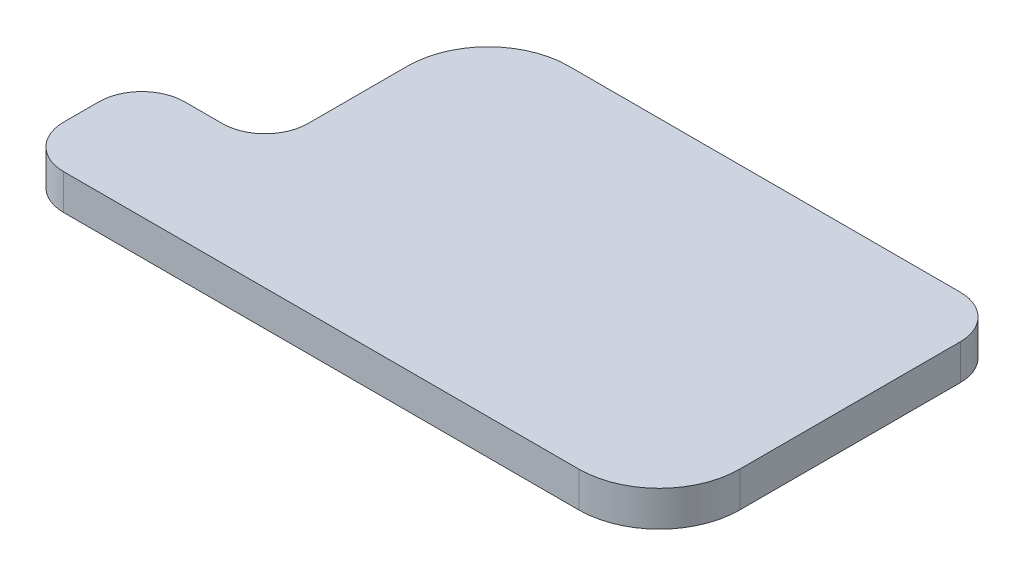
from build123d import *

# Parameters (mm, degrees)
BOSS_EXTRUDE1_DEPTH = 1.32
FILLET1_R           = 3
FILLET2_R           = 1.6


with BuildPart() as part:
    # Sketch1 → Boss-Extrude1 (new body)
    with BuildSketch(Plane(origin=(0, 0, 0), x_dir=(1, 0, 0), z_dir=(0, 1, 0))):
        Polygon((0, 4.51), (0, 0), (23.8, 0), (23.8, 12.82), (4.6, 12.82), (4.6, 4.51), align=None)
    extrude(amount=BOSS_EXTRUDE1_DEPTH)

    # Fillet1
    fillet1_edges = [part.edges().sort_by_distance(p)[0] for p in [
        (4.6, 0.66, -12.82),
        (23.8, 0.66, 0),
    ]]
    fillet(fillet1_edges, radius=FILLET1_R)

    # Fillet2
    fillet2_edges = [part.edges().sort_by_distance(p)[0] for p in [
        (0, 0.66, -4.51),
        (4.6, 0.66, -4.51),
        (23.8, 0.66, -12.82),
        (0, 0.66, 0),
    ]]
    fillet(fillet2_edges, radius=FILLET2_R)


solid = part.part
